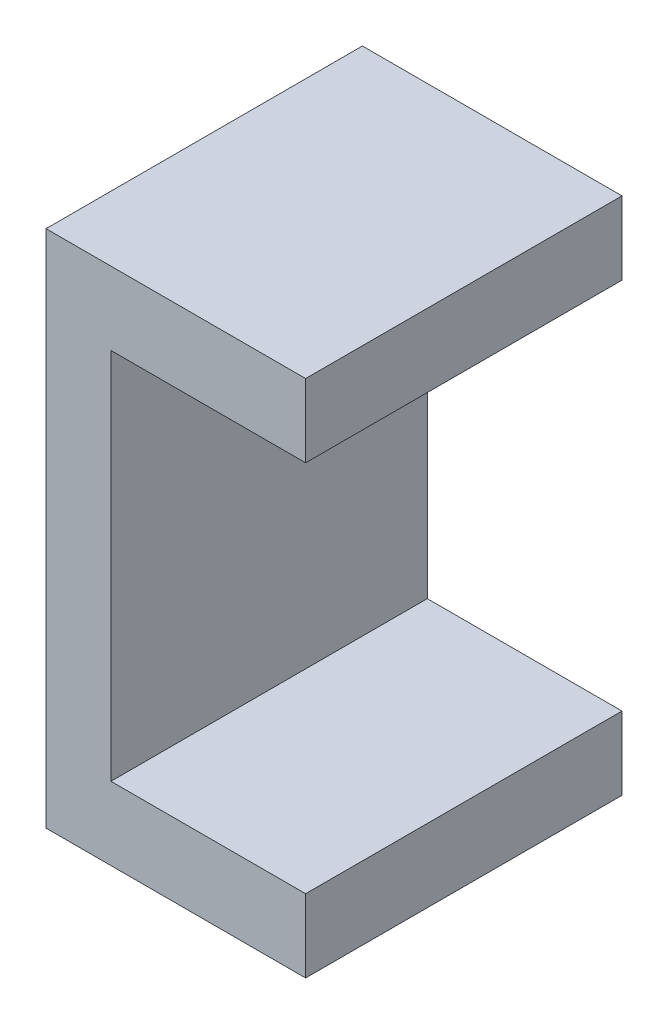
from build123d import *

# Parameters (mm, degrees)
BOSS_EXTRUDE1_DEPTH = 19.5


with BuildPart() as part:
    # Sketch1 → Boss-Extrude1 (new body)
    with BuildSketch(Plane.XY):
        Polygon((-10, -16), (-6, -16), (6, -16), (6, -11.5), (-6, -11.5), (-6, 11.5), (6, 11.5), (6, 16), (-6, 16), (-10, 16), align=None)
    extrude(amount=BOSS_EXTRUDE1_DEPTH)


solid = part.part
